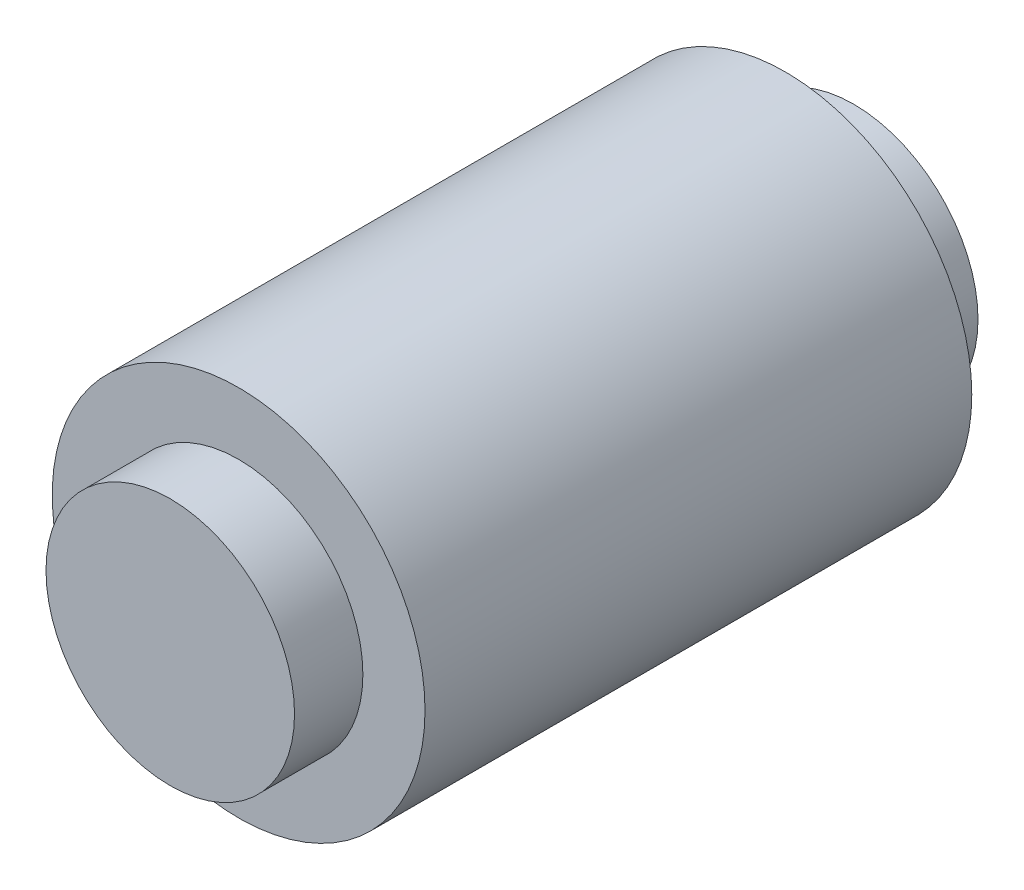
from build123d import *

# Parameters (mm, degrees)
SKETCH1_R           = 15
BOSS_EXTRUDE1_DEPTH = 44
SKETCH4_R           = 10
BOSS_EXTRUDE2_DEPTH = 5.5
BOSS_EXTRUDE3_START = 5.5
SKETCH5_R           = 10
BOSS_EXTRUDE3_DEPTH = 5.5


with BuildPart() as part:
    # Sketch1 → Boss-Extrude1 (new body)
    with BuildSketch(Plane.XY):
        Circle(SKETCH1_R)
    extrude(amount=BOSS_EXTRUDE1_DEPTH)

    # Sketch4 → Boss-Extrude2 (add)
    with BuildSketch(Plane.XY.offset(44)):
        Circle(SKETCH4_R)
    extrude(amount=BOSS_EXTRUDE2_DEPTH)

    # Sketch5 → Boss-Extrude3 (add)
    with BuildSketch(Plane(origin=(0, 0, 0), x_dir=(-1, 0, 0), z_dir=(0, 0, -1)).offset(BOSS_EXTRUDE3_START)):
        with Locations(Location((0, 0, 0), (0, 0, 180))):
            Circle(SKETCH5_R)
    extrude(amount=-BOSS_EXTRUDE3_DEPTH)


solid = part.part
